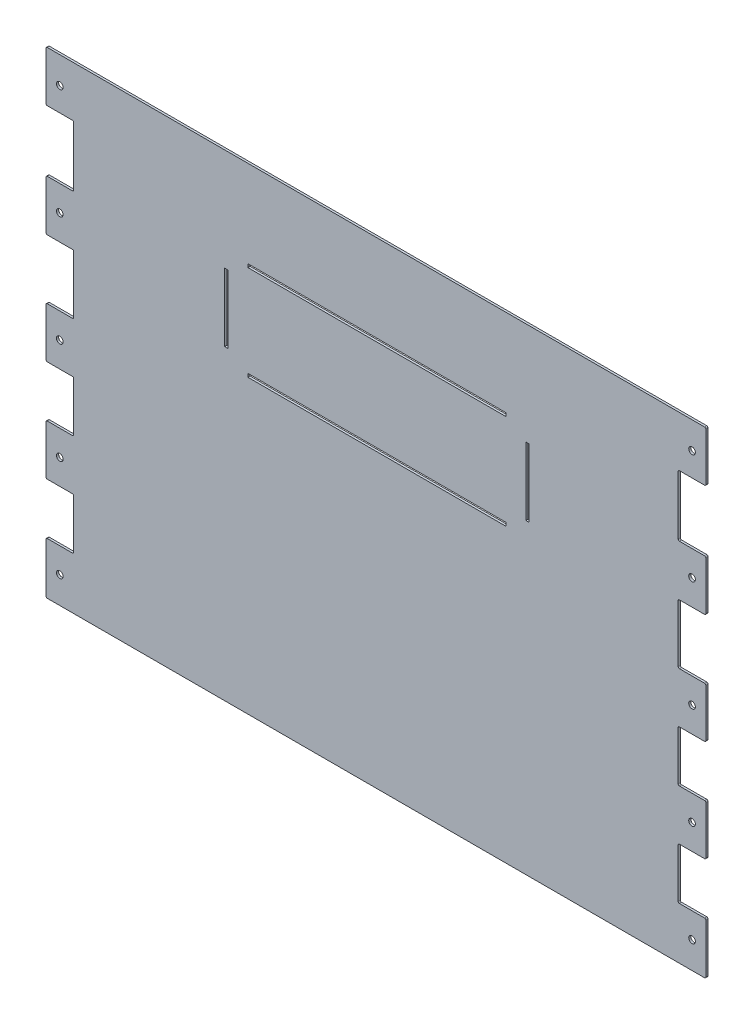
from build123d import *

# Parameters (mm, degrees)
SKETCH1_R           = 3.5
SKETCH1_W           = 271.54175435
SKETCH1_H           = 3.556
SKETCH1_W_2         = 3.556
SKETCH1_H_2         = 71.4883
BOSS_EXTRUDE1_DEPTH = 2.286
FILLET1_R           = 1.27


with BuildPart() as part:
    # Sketch1 → Boss-Extrude1 (new body)
    with BuildSketch(Plane.XY):
        Polygon((-190.471476969, 191.42838219), (503.700363031, 191.42838219), (503.700363031, 138.32838219), (474.617169309, 138.32838219), (474.617169309, 74.041741872), (503.700363031, 74.041741872), (503.700363031, 20.629767615), (474.617169309, 20.629767615), (474.617169309, -42.077913962), (503.700363031, -42.077913962), (503.700363031, -95.085831367), (474.617169309, -95.085831367), (474.617169309, -148.942582796), (503.700363031, -148.942582796), (503.700363031, -201.978007641), (474.617169309, -201.978007641), (474.617169309, -256.009209725), (503.700363031, -256.009209725), (503.700363031, -310.51371781), (-190.471476969, -310.51371781), (-190.471476969, -256.009209725), (-161.388283246, -256.009209725), (-161.388283246, -201.978007641), (-190.471476969, -201.978007641), (-190.471476969, -148.942582796), (-161.388283246, -148.942582796), (-161.388283246, -95.085831367), (-190.471476969, -95.085831367), (-190.471476969, -42.077913962), (-161.388283246, -42.077913962), (-161.388283246, 20.629767615), (-190.471476969, 20.629767615), (-190.471476969, 74.041741872), (-161.388283246, 74.041741872), (-161.388283246, 138.32838219), (-190.471476969, 138.32838219), align=None)
        with Locations((-175.993476969, 163.253382152)):
            Circle(SKETCH1_R, mode=Mode.SUBTRACT)
        with Locations((-175.993476969, 47.335754744)):
            Circle(SKETCH1_R, mode=Mode.SUBTRACT)
        with Locations((-175.993476969, -68.581872664)):
            Circle(SKETCH1_R, mode=Mode.SUBTRACT)
        with Locations((-175.993476969, -175.460295218)):
            Circle(SKETCH1_R, mode=Mode.SUBTRACT)
        with Locations((-175.993476969, -282.338717772)):
            Circle(SKETCH1_R, mode=Mode.SUBTRACT)
        with Locations((489.222363031, 163.253382152)):
            Circle(SKETCH1_R, mode=Mode.SUBTRACT)
        with Locations((489.222363031, 47.335754744)):
            Circle(SKETCH1_R, mode=Mode.SUBTRACT)
        with Locations((489.222363031, -68.581872664)):
            Circle(SKETCH1_R, mode=Mode.SUBTRACT)
        with Locations((489.222363031, -175.460295218)):
            Circle(SKETCH1_R, mode=Mode.SUBTRACT)
        with Locations((489.222363031, -282.338717772)):
            Circle(SKETCH1_R, mode=Mode.SUBTRACT)
        with Locations((157.69971, 98.1583)):
            Rectangle(SKETCH1_W, SKETCH1_H, mode=Mode.SUBTRACT)
        with Locations((-0.762, 47.93615)):
            Rectangle(SKETCH1_W_2, SKETCH1_H_2, mode=Mode.SUBTRACT)
        with Locations((316.16142, 47.93615)):
            Rectangle(SKETCH1_W_2, SKETCH1_H_2, mode=Mode.SUBTRACT)
        with Locations((157.69971, -1.778)):
            Rectangle(SKETCH1_W, SKETCH1_H, mode=Mode.SUBTRACT)
    extrude(amount=BOSS_EXTRUDE1_DEPTH)

    # Fillet1
    fillet1_edges = [part.edges().sort_by_distance(p)[0] for p in [
        (-161.388283246, 74.041741872, 1.143),
        (-161.388283246, 138.32838219, 1.143),
        (-190.471476969, 138.32838219, 1.143),
        (-190.471476969, 191.42838219, 1.143),
        (503.700363031, 191.42838219, 1.143),
        (503.700363031, 138.32838219, 1.143),
        (474.617169309, 138.32838219, 1.143),
        (474.617169309, 74.041741872, 1.143),
        (503.700363031, 74.041741872, 1.143),
        (503.700363031, 20.629767615, 1.143),
        (474.617169309, 20.629767615, 1.143),
        (474.617169309, -42.077913962, 1.143),
        (503.700363031, -42.077913962, 1.143),
        (503.700363031, -95.085831367, 1.143),
        (474.617169309, -95.085831367, 1.143),
        (474.617169309, -148.942582796, 1.143),
        (503.700363031, -148.942582796, 1.143),
        (503.700363031, -201.978007641, 1.143),
        (474.617169309, -201.978007641, 1.143),
        (474.617169309, -256.009209725, 1.143),
        (503.700363031, -256.009209725, 1.143),
        (503.700363031, -310.51371781, 1.143),
        (-190.471476969, -310.51371781, 1.143),
        (-190.471476969, -256.009209725, 1.143),
        (-161.388283246, -256.009209725, 1.143),
        (-161.388283246, -201.978007641, 1.143),
        (-190.471476969, -201.978007641, 1.143),
        (-190.471476969, -148.942582796, 1.143),
        (-161.388283246, -148.942582796, 1.143),
        (-161.388283246, -95.085831367, 1.143),
        (-190.471476969, -95.085831367, 1.143),
        (-190.471476969, -42.077913962, 1.143),
        (-161.388283246, -42.077913962, 1.143),
        (-161.388283246, 20.629767615, 1.143),
        (-190.471476969, 20.629767615, 1.143),
        (-190.471476969, 74.041741872, 1.143),
    ]]
    fillet(fillet1_edges, radius=FILLET1_R)


solid = part.part
